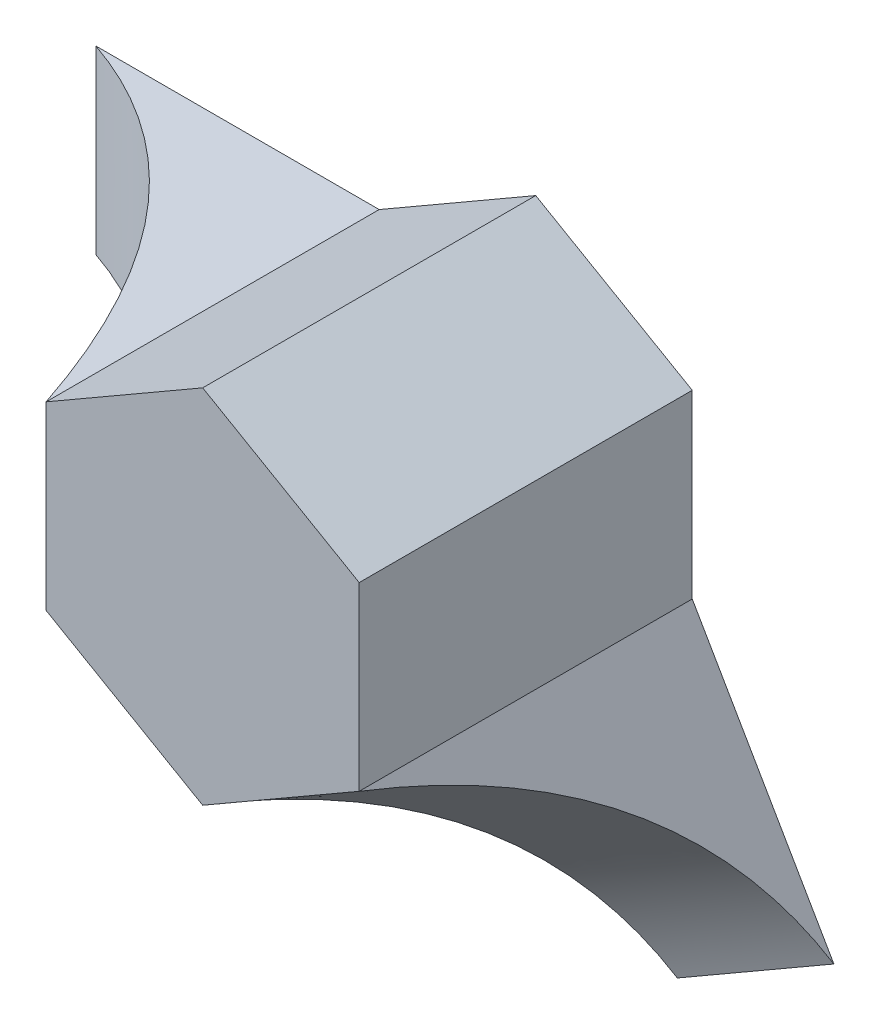
from build123d import *

# Parameters (mm, degrees)
SALIENTE_EXTRUIR1_DEPTH = 47.5
SALIENTE_EXTRUIR2_DEPTH = 51.556282
SALIENTE_EXTRUIR3_DEPTH = 51.556282


with BuildPart() as part:
    # Croquis1 → Saliente-Extruir1 (new, symmetric)
    with BuildSketch(Plane.XY):
        Polygon((44.649051179, 25.778141718), (0, 51.556283435), (-44.649051179, 25.778141718), (-44.649051179, -25.778141718), (0, -51.556283435), (44.649051179, -25.778141718), align=None)
    extrude(amount=SALIENTE_EXTRUIR1_DEPTH, both=True)

    # Croquis6 → Saliente-Extruir2 (add)
    with BuildSketch(Plane(origin=(22.32452559, 12.889070859, 0), x_dir=(0, 0, -1), z_dir=(-0.8660254037844388, -0.49999999999999983, 0))):
        with BuildLine():
            Line((-47.516964524, 44.649051179), (47.5, 44.649051179))
            Line((47.5, 44.649051179), (47.5, 125.450551246))
            add(Edge.make_bspline(
                [(47.5, 125.450551246), (28.48813233, 69.96313115), (-47.516964524, 44.649051179)],
                knots=[0, 0, 0, 1, 1, 1], degree=2))
        make_face()
    extrude(amount=SALIENTE_EXTRUIR2_DEPTH)

    # Croquis8 → Saliente-Extruir3 (add)
    with BuildSketch(Plane(origin=(0, 25.778141718, 0), x_dir=(0, 0, -1), z_dir=(0, 1, 0))):
        with BuildLine():
            Line((47.5, 44.649051179), (47.5, 125.452857029))
            add(Edge.make_bspline(
                [(47.5, 125.452857029), (28.489618358, 69.977349558), (-47.490800068, 44.66905118)],
                knots=[0, 0, 0, 1, 1, 1], degree=2))
            Line((-47.490800068, 44.66905118), (-47.5, 44.649051179))
            Line((-47.5, 44.649051179), (47.5, 44.649051179))
        make_face()
    extrude(amount=-SALIENTE_EXTRUIR3_DEPTH)


solid = part.part
